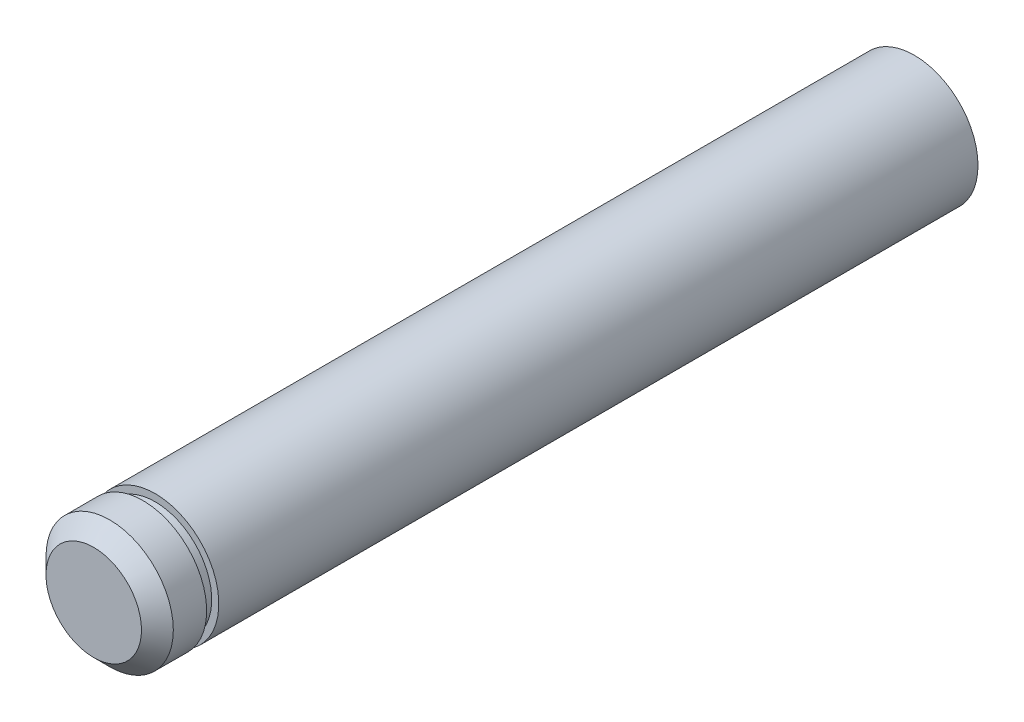
from build123d import *

# Parameters (mm, degrees)
SKETCH1_R                  = 4
BOSS_EXTRUDE1_DEPTH        = 51.562
SKETCH2_W                  = 0.444
SKETCH2_H                  = 0.762
CHAMFER2_SIZE              = 1
F_10_32_TAPPED_HOLE2_D     = 4.0386
F_10_32_TAPPED_HOLE2_DEPTH = 12.7
F_10_32_TAPPED_HOLE2_TIP   = 1.213317848


with BuildPart() as part:
    # Sketch1 → Boss-Extrude1 (new body)
    with BuildSketch(Plane.XY):
        Circle(SKETCH1_R)
    extrude(amount=BOSS_EXTRUDE1_DEPTH)

    # Sketch2 → Cut-Revolve1 (revolve, cut)
    with BuildSketch(Plane(origin=(0, 0, 0), x_dir=(1, 0, 0), z_dir=(0, 1, 0)), mode=Mode.PRIVATE) as cut_revolve1_sk:
        with Locations((3.778, -48.086)):
            Rectangle(SKETCH2_W, SKETCH2_H)
    revolve(cut_revolve1_sk.sketch.rotate(Axis((0, 0, 0), (0, 0, 1)), 180), axis=Axis((0, 0, 0), (0, 0, 1)), mode=Mode.SUBTRACT)

    # Chamfer2
    chamfer2_edges = [part.edges().sort_by_distance(p)[0] for p in [
        (-4, 0, 51.562),
    ]]
    chamfer(chamfer2_edges, length=CHAMFER2_SIZE)

    # #10-32 Tapped Hole2
    with Locations(Plane(origin=(0, 0, 0), x_dir=(-1, 0, 0), z_dir=(0, 0, -1))):
        with Locations((0, 0)):
            Hole(F_10_32_TAPPED_HOLE2_D / 2, depth=F_10_32_TAPPED_HOLE2_DEPTH)
            with Locations((0, 0, -(F_10_32_TAPPED_HOLE2_DEPTH + F_10_32_TAPPED_HOLE2_TIP / 2))):  # 118° drill point
                Cone(0, F_10_32_TAPPED_HOLE2_D / 2, F_10_32_TAPPED_HOLE2_TIP, mode=Mode.SUBTRACT)


solid = part.part
